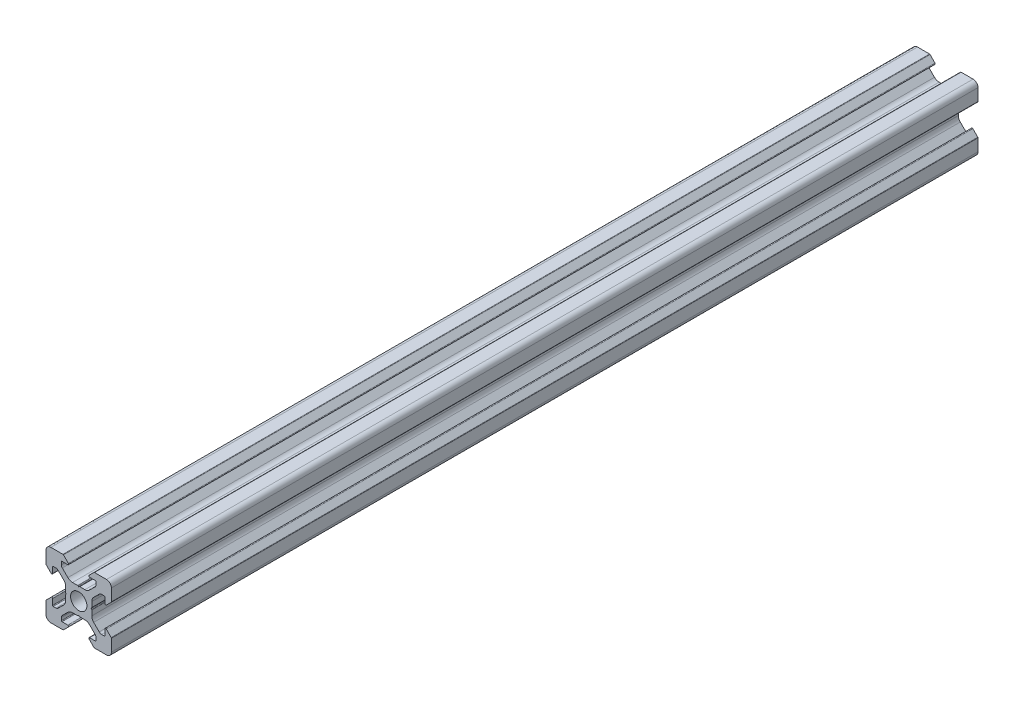
from build123d import *

# Parameters (mm, degrees)
MODEL_R         = 2.5
EXTRUDE_1_DEPTH = 265


with BuildPart() as part:
    # Model → Бобышка-Вытянуть1 (new body)
    with BuildSketch(Plane.XY):
        with BuildLine():
            Line((18.94214915, 33.362214718), (18.94214915, 34.923300122))
            ThreePointArc((18.94214915, 34.923300122), (18.789908215, 35.688666987), (18.356362712, 36.337513684))
            Line((18.356362712, 36.337513684), (16.662250163, 38.031626234))
            ThreePointArc((16.662250163, 38.031626234), (16.337826814, 38.248398985), (15.955143382, 38.324519453))
            Line((15.955143382, 38.324519453), (15.14214915, 38.324519453))
            ThreePointArc((15.14214915, 38.324519453), (15.000727794, 38.265940809), (14.94214915, 38.124519453))
            Line((14.94214915, 38.124519453), (14.94214915, 36.354519453))
            ThreePointArc((14.94214915, 36.354519453), (14.787820008, 36.12354957), (14.515372455, 36.177742757))
            Line((14.515372455, 36.177742757), (13.015372455, 37.677742757))
            ThreePointArc((13.015372455, 37.677742757), (12.961179267, 37.758848595), (12.94214915, 37.854519453))
            Line((12.94214915, 37.854519453), (12.94214915, 41.524519453))
            ThreePointArc((12.94214915, 41.524519453), (13.381488978, 42.585179625), (14.44214915, 43.024519453))
            Line((14.44214915, 43.024519453), (18.11214915, 43.024519453))
            ThreePointArc((18.11214915, 43.024519453), (18.207820008, 43.005489336), (18.288925845, 42.951296148))
            Line((18.288925845, 42.951296148), (19.788925845, 41.451296148))
            ThreePointArc((19.788925845, 41.451296148), (19.843119033, 41.178848595), (19.61214915, 41.024519453))
            Line((19.61214915, 41.024519453), (17.84214915, 41.024519453))
            ThreePointArc((17.84214915, 41.024519453), (17.700727794, 40.965940809), (17.64214915, 40.824519453))
            Line((17.64214915, 40.824519453), (17.64214915, 40.011525221))
            ThreePointArc((17.64214915, 40.011525221), (17.718269617, 39.628841789), (17.935042369, 39.30441844))
            Line((17.935042369, 39.30441844), (19.629154919, 37.61030589))
            ThreePointArc((19.629154919, 37.61030589), (20.278001616, 37.176760388), (21.043368481, 37.024519453))
            Line((21.043368481, 37.024519453), (22.604453885, 37.024519453))
            ThreePointArc((22.604453885, 37.024519453), (22.687205621, 37.010426533), (22.760627647, 36.969736655))
            Line((22.760627647, 36.969736655), (22.94214915, 36.824519453))
            Line((22.94214915, 36.824519453), (23.123670653, 36.969736655))
            ThreePointArc((23.123670653, 36.969736655), (23.197092679, 37.010426533), (23.279844415, 37.024519453))
            Line((23.279844415, 37.024519453), (24.840929819, 37.024519453))
            ThreePointArc((24.840929819, 37.024519453), (25.606296684, 37.176760388), (26.255143382, 37.61030589))
            Line((26.255143382, 37.61030589), (27.949255931, 39.30441844))
            ThreePointArc((27.949255931, 39.30441844), (28.166028683, 39.628841789), (28.24214915, 40.011525221))
            Line((28.24214915, 40.011525221), (28.24214915, 40.824519453))
            ThreePointArc((28.24214915, 40.824519453), (28.183570506, 40.965940809), (28.04214915, 41.024519453))
            Line((28.04214915, 41.024519453), (26.27214915, 41.024519453))
            ThreePointArc((26.27214915, 41.024519453), (26.041179267, 41.178848595), (26.095372455, 41.451296148))
            Line((26.095372455, 41.451296148), (27.595372455, 42.951296148))
            ThreePointArc((27.595372455, 42.951296148), (27.676478292, 43.005489336), (27.77214915, 43.024519453))
            Line((27.77214915, 43.024519453), (31.44214915, 43.024519453))
            ThreePointArc((31.44214915, 43.024519453), (32.502809322, 42.585179625), (32.94214915, 41.524519453))
            Line((32.94214915, 41.524519453), (32.94214915, 37.854519453))
            ThreePointArc((32.94214915, 37.854519453), (32.923119033, 37.758848595), (32.868925845, 37.677742757))
            Line((32.868925845, 37.677742757), (31.368925845, 36.177742757))
            ThreePointArc((31.368925845, 36.177742757), (31.096478292, 36.12354957), (30.94214915, 36.354519453))
            Line((30.94214915, 36.354519453), (30.94214915, 38.124519453))
            ThreePointArc((30.94214915, 38.124519453), (30.883570506, 38.265940809), (30.74214915, 38.324519453))
            Line((30.74214915, 38.324519453), (29.929154919, 38.324519453))
            ThreePointArc((29.929154919, 38.324519453), (29.546471486, 38.248398985), (29.222048137, 38.031626234))
            Line((29.222048137, 38.031626234), (27.527935588, 36.337513684))
            ThreePointArc((27.527935588, 36.337513684), (27.094390085, 35.688666987), (26.94214915, 34.923300122))
            Line((26.94214915, 34.923300122), (26.94214915, 33.362214718))
            ThreePointArc((26.94214915, 33.362214718), (26.92805623, 33.279462982), (26.887366352, 33.206040956))
            Line((26.887366352, 33.206040956), (26.74214915, 33.024519453))
            Line((26.74214915, 33.024519453), (26.887366352, 32.84299795))
            ThreePointArc((26.887366352, 32.84299795), (26.92805623, 32.769575923), (26.94214915, 32.686824188))
            Line((26.94214915, 32.686824188), (26.94214915, 31.125738784))
            ThreePointArc((26.94214915, 31.125738784), (27.094390085, 30.360371919), (27.527935588, 29.711525221))
            Line((27.527935588, 29.711525221), (29.222048137, 28.017412672))
            ThreePointArc((29.222048137, 28.017412672), (29.546471486, 27.80063992), (29.929154919, 27.724519453))
            Line((29.929154919, 27.724519453), (30.74214915, 27.724519453))
            ThreePointArc((30.74214915, 27.724519453), (30.883570506, 27.783098097), (30.94214915, 27.924519453))
            Line((30.94214915, 27.924519453), (30.94214915, 29.694519453))
            ThreePointArc((30.94214915, 29.694519453), (31.096478292, 29.925489336), (31.368925845, 29.871296148))
            Line((31.368925845, 29.871296148), (32.868925845, 28.371296148))
            ThreePointArc((32.868925845, 28.371296148), (32.923119033, 28.290190311), (32.94214915, 28.194519453))
            Line((32.94214915, 28.194519453), (32.94214915, 24.524519453))
            ThreePointArc((32.94214915, 24.524519453), (32.502809322, 23.463859281), (31.44214915, 23.024519453))
            Line((31.44214915, 23.024519453), (27.77214915, 23.024519453))
            ThreePointArc((27.77214915, 23.024519453), (27.676478292, 23.04354957), (27.595372455, 23.097742757))
            Line((27.595372455, 23.097742757), (26.095372455, 24.597742757))
            ThreePointArc((26.095372455, 24.597742757), (26.041179267, 24.870190311), (26.27214915, 25.024519453))
            Line((26.27214915, 25.024519453), (28.04214915, 25.024519453))
            ThreePointArc((28.04214915, 25.024519453), (28.183570506, 25.083098097), (28.24214915, 25.224519453))
            Line((28.24214915, 25.224519453), (28.24214915, 26.037513684))
            ThreePointArc((28.24214915, 26.037513684), (28.166028683, 26.420197117), (27.949255931, 26.744620465))
            Line((27.949255931, 26.744620465), (26.255143382, 28.438733015))
            ThreePointArc((26.255143382, 28.438733015), (25.606296684, 28.872278518), (24.840929819, 29.024519453))
            Line((24.840929819, 29.024519453), (23.279844415, 29.024519453))
            ThreePointArc((23.279844415, 29.024519453), (23.197092679, 29.038612373), (23.123670653, 29.07930225))
            Line((23.123670653, 29.07930225), (22.94214915, 29.224519453))
            Line((22.94214915, 29.224519453), (22.760627647, 29.07930225))
            ThreePointArc((22.760627647, 29.07930225), (22.687205621, 29.038612373), (22.604453885, 29.024519453))
            Line((22.604453885, 29.024519453), (21.043368481, 29.024519453))
            ThreePointArc((21.043368481, 29.024519453), (20.278001616, 28.872278518), (19.629154919, 28.438733015))
            Line((19.629154919, 28.438733015), (17.935042369, 26.744620465))
            ThreePointArc((17.935042369, 26.744620465), (17.718269617, 26.420197117), (17.64214915, 26.037513684))
            Line((17.64214915, 26.037513684), (17.64214915, 25.224519453))
            ThreePointArc((17.64214915, 25.224519453), (17.700727794, 25.083098097), (17.84214915, 25.024519453))
            Line((17.84214915, 25.024519453), (19.61214915, 25.024519453))
            ThreePointArc((19.61214915, 25.024519453), (19.843119033, 24.870190311), (19.788925845, 24.597742757))
            Line((19.788925845, 24.597742757), (18.288925845, 23.097742757))
            ThreePointArc((18.288925845, 23.097742757), (18.207820008, 23.04354957), (18.11214915, 23.024519453))
            Line((18.11214915, 23.024519453), (14.44214915, 23.024519453))
            ThreePointArc((14.44214915, 23.024519453), (13.381488978, 23.463859281), (12.94214915, 24.524519453))
            Line((12.94214915, 24.524519453), (12.94214915, 28.194519453))
            ThreePointArc((12.94214915, 28.194519453), (12.961179267, 28.290190311), (13.015372455, 28.371296148))
            Line((13.015372455, 28.371296148), (14.515372455, 29.871296148))
            ThreePointArc((14.515372455, 29.871296148), (14.787820008, 29.925489336), (14.94214915, 29.694519453))
            Line((14.94214915, 29.694519453), (14.94214915, 27.924519453))
            ThreePointArc((14.94214915, 27.924519453), (15.000727794, 27.783098097), (15.14214915, 27.724519453))
            Line((15.14214915, 27.724519453), (15.955143382, 27.724519453))
            ThreePointArc((15.955143382, 27.724519453), (16.337826814, 27.80063992), (16.662250163, 28.017412672))
            Line((16.662250163, 28.017412672), (18.356362712, 29.711525221))
            ThreePointArc((18.356362712, 29.711525221), (18.789908215, 30.360371919), (18.94214915, 31.125738784))
            Line((18.94214915, 31.125738784), (18.94214915, 32.686824188))
            ThreePointArc((18.94214915, 32.686824188), (18.95624207, 32.769575923), (18.996931948, 32.84299795))
            Line((18.996931948, 32.84299795), (19.14214915, 33.024519453))
            Line((19.14214915, 33.024519453), (18.996931948, 33.206040956))
            ThreePointArc((18.996931948, 33.206040956), (18.95624207, 33.279462982), (18.94214915, 33.362214718))
        make_face()
        with Locations((22.94214915, 33.024519453)):
            Circle(MODEL_R, mode=Mode.SUBTRACT)
    extrude(amount=EXTRUDE_1_DEPTH)


solid = part.part
